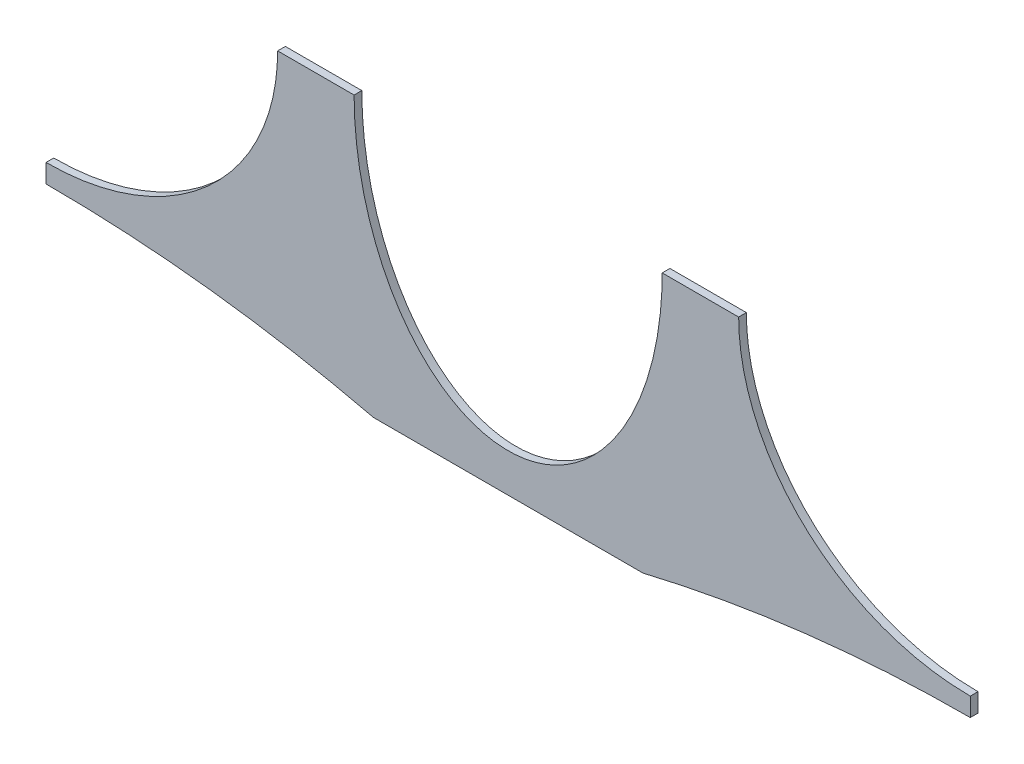
from build123d import *

# Parameters (mm, degrees)
BOSS_EXTRUDE1_DEPTH = 2.54


with BuildPart() as part:
    # Sketch1 → Boss-Extrude1 (new body)
    with BuildSketch(Plane.XY):
        with BuildLine():
            Line((-76.0134243, 76.2), (-50.8, 76.2))
            add(Edge.make_bspline(
                [(-50.8, 76.2), (-50.8, 0), (0, 0), (50.8, 0), (50.8, 76.2)],
                knots=[1.570796327, 1.570796327, 1.570796327, 3.141592654, 3.141592654, 4.71238898, 4.71238898, 4.71238898], degree=2, weights=[1, 0.707106781, 1, 0.707106781, 1]))
            Line((50.8, 76.2), (76.0134243, 76.2))
            add(Edge.make_bspline(
                [(76.0134243, 76.2), (76.0134243, 6.136883435), (152.4, 6.136883435)],
                knots=[0, 0, 0, 1.570796327, 1.570796327, 1.570796327], degree=2, weights=[1, 0.707106781, 1]))
            Line((152.4, 6.136883435), (152.4, 0))
            ThreePointArc((152.4, 0), (98.05275421, -3.185910782), (44.45, -12.7))
            Line((44.45, -12.7), (-44.45, -12.7))
            ThreePointArc((-44.45, -12.7), (-98.05275421, -3.185910782), (-152.4, 0))
            Line((-152.4, 0), (-152.4, 6.136883435))
            add(Edge.make_bspline(
                [(-152.4, 6.136883435), (-76.0134243, 6.136883435), (-76.0134243, 76.2)],
                knots=[4.71238898, 4.71238898, 4.71238898, 6.283185307, 6.283185307, 6.283185307], degree=2, weights=[1, 0.707106781, 1]))
        make_face()
    extrude(amount=BOSS_EXTRUDE1_DEPTH)


solid = part.part
